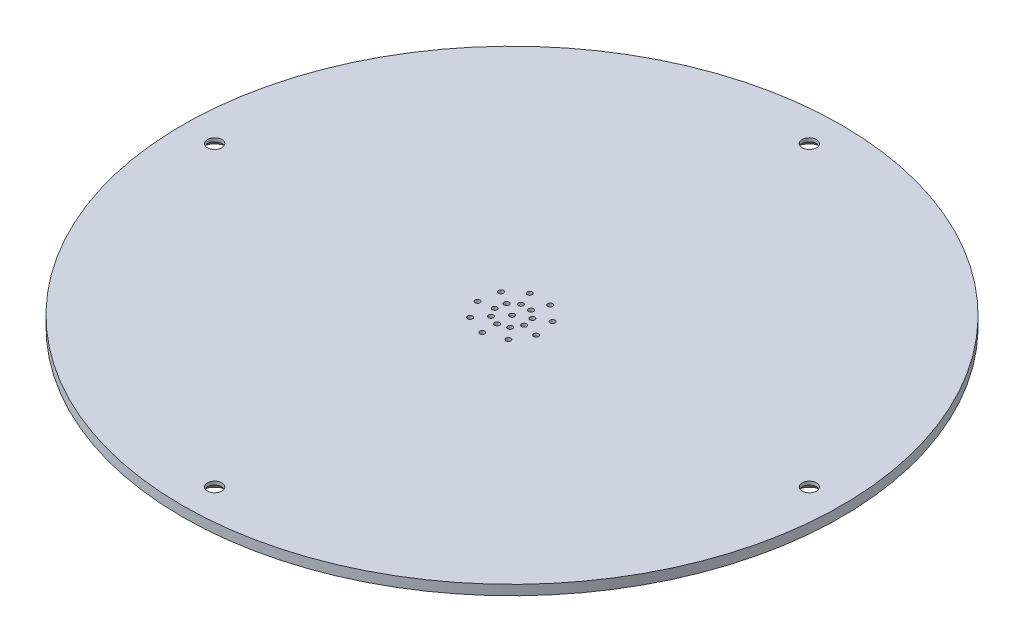
from build123d import *

# Parameters (mm, degrees)
SKETCH3_R                                         = 66.5
BOSS_EXTRUDE1_DEPTH                               = 2
CSK_FOR_M2_5_FLAT_HEAD_MACHINE_SCREW2_D           = 2.9
CSK_FOR_M2_5_FLAT_HEAD_MACHINE_SCREW2_DEPTH       = 2
CSK_FOR_M2_5_FLAT_HEAD_MACHINE_SCREW2_CSINK_D     = 5.5
CSK_FOR_M2_5_FLAT_HEAD_MACHINE_SCREW2_CSINK_ANGLE = 90
CSK_FOR_M2_5_FLAT_HEAD_MACHINE_SCREW2_TIP         = 0.871247898
SKETCH4_R                                         = 2.5
CUT_EXTRUDE1_DEPTH                                = 1
CIRPATTERN1_COUNT                                 = 4
SKETCH9_R                                         = 0.5
CUT_EXTRUDE2_DEPTH                                = 95.066465863
CIRPATTERN2_COUNT                                 = 9


with BuildPart() as part:
    # Sketch3 → Boss-Extrude1 (new body)
    with BuildSketch(Plane(origin=(0, 0, 0), x_dir=(1, 0, 0), z_dir=(0, 1, 0))):
        with Locations(Location((0, 0, 0), (0, 0, 270))):
            Circle(SKETCH3_R)
    extrude(amount=BOSS_EXTRUDE1_DEPTH)

    # CSK for M2.5 Flat Head Machine Screw2
    with Locations(Plane(origin=(0, 0, 0), x_dir=(-1, 0, 0), z_dir=(0, -1, 0))):
        with Locations((-60, 0), (0, 60), (60, 0), (0, -60)):
            CounterSinkHole(CSK_FOR_M2_5_FLAT_HEAD_MACHINE_SCREW2_D / 2, CSK_FOR_M2_5_FLAT_HEAD_MACHINE_SCREW2_CSINK_D / 2, depth=CSK_FOR_M2_5_FLAT_HEAD_MACHINE_SCREW2_DEPTH, counter_sink_angle=CSK_FOR_M2_5_FLAT_HEAD_MACHINE_SCREW2_CSINK_ANGLE)
            with Locations((0, 0, -(CSK_FOR_M2_5_FLAT_HEAD_MACHINE_SCREW2_DEPTH + CSK_FOR_M2_5_FLAT_HEAD_MACHINE_SCREW2_TIP / 2))):  # 118° drill point
                Cone(0, CSK_FOR_M2_5_FLAT_HEAD_MACHINE_SCREW2_D / 2, CSK_FOR_M2_5_FLAT_HEAD_MACHINE_SCREW2_TIP, mode=Mode.SUBTRACT)

    # Sketch4 → Cut-Extrude1 (cut)
    with BuildSketch(Plane(origin=(0, 0, 0), x_dir=(-1, 0, 0), z_dir=(0, -1, 0))):
        with Locations(Location((-38.890872965, 38.890872965, 0), (0, 0, 90))):
            Circle(SKETCH4_R)
    cut_extrude1 = extrude(amount=-CUT_EXTRUDE1_DEPTH, mode=Mode.SUBTRACT)

    # CirPattern1: Cut-Extrude1 ×4 about axis
    cirpattern1_axis = Axis((-0.05542221, 0, 0.05542221), (0, 1, 0))
    for i in range(1, CIRPATTERN1_COUNT):
        add(cut_extrude1.rotate(cirpattern1_axis, i * 360 / CIRPATTERN1_COUNT), mode=Mode.SUBTRACT)

    # Sketch9 → Cut-Extrude2 (cut, through all)
    with BuildSketch(Plane.XZ):
        with Locations(Location((0, 0, 0), (0, 0, 270))):
            Circle(SKETCH9_R)
        with Locations(Location((0, 3, 0), (0, 0, 270))):
            Circle(SKETCH9_R)
        with Locations(Location((0, 6, 0), (0, 0, 270))):
            Circle(SKETCH9_R)
    cut_extrude2 = extrude(amount=-CUT_EXTRUDE2_DEPTH, mode=Mode.SUBTRACT)

    # CirPattern2: Cut-Extrude2 ×9 about axis
    cirpattern2_axis = Axis((0, 0, 0), (0, 1, 0))
    for i in range(1, CIRPATTERN2_COUNT):
        add(cut_extrude2.rotate(cirpattern2_axis, i * 360 / CIRPATTERN2_COUNT), mode=Mode.SUBTRACT)


solid = part.part
